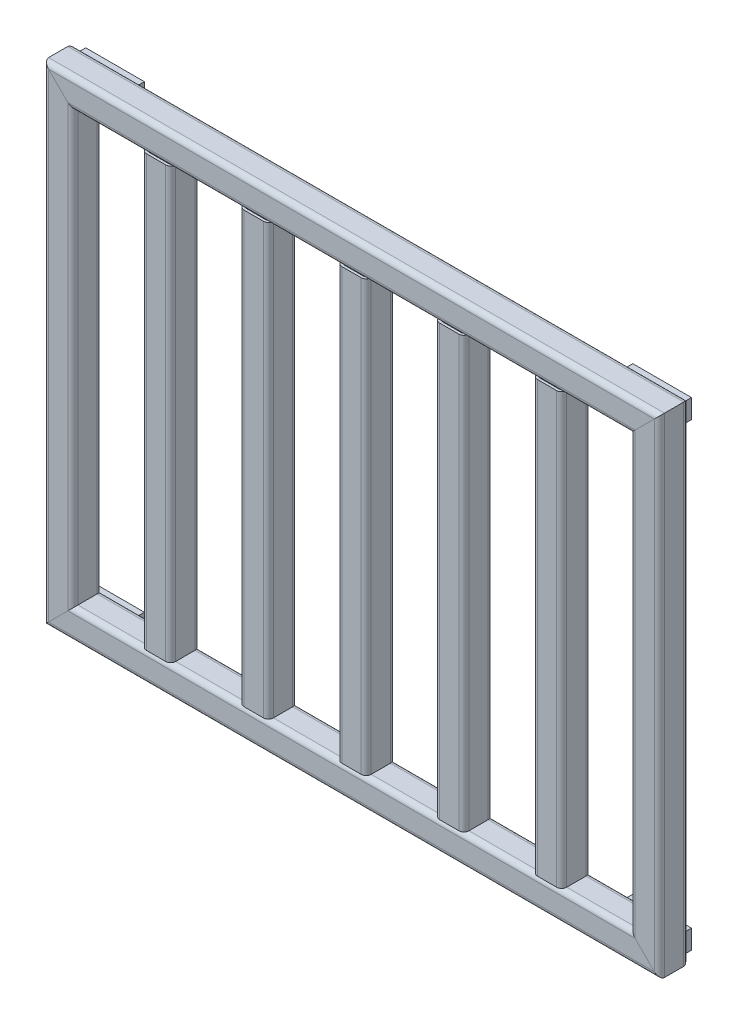
from build123d import *

# Parameters (mm, degrees)
KARE_T_P_30_X_30_X_2_6_1_DEPTH      = 492.213203436
KARE_T_P_30_X_30_X_2_6_1_DEPTH_BACK = 22.213203436
KARE_T_P_30_X_30_X_2_6_1_2_DEPTH    = 644.426406871
KARE_T_P_30_X_30_X_2_6_1_3_DEPTH    = 514.426406871
KARE_T_P_30_X_30_X_2_6_1_4_DEPTH    = 644.426406871
KARE_T_P_30_X_30_X_2_6_1_5_DEPTH    = 472
KARE_T_P_30_X_30_X_2_6_1_6_DEPTH    = 472
KARE_T_P_30_X_30_X_2_6_1_7_DEPTH    = 472
KARE_T_P_30_X_30_X_2_6_1_8_DEPTH    = 472
KARE_T_P_30_X_30_X_2_6_1_9_DEPTH    = 472
IZIM2_W                             = 60
IZIM2_H                             = 19.6
Y_KSEKLIK_EKSTR_ZYON1_DEPTH         = 8
Y_KSEKLIK_EKSTR_ZYON1_2_DEPTH       = 8
Y_KSEKLIK_EKSTR_ZYON1_3_DEPTH       = 8
Y_KSEKLIK_EKSTR_ZYON1_4_DEPTH       = 8


with BuildPart() as part:
    # Sketch1 → Kare tüp 30 X 30 X 2.6(1) (new, two sides: drawn at the far end of the back side and taken through both)
    with BuildSketch(Plane(origin=(300, 235, 0), x_dir=(1, 0, 0), z_dir=(0, -1, 0)).offset(-KARE_T_P_30_X_30_X_2_6_1_DEPTH_BACK)):
        with BuildLine():
            Line((-9.8, -15), (9.8, -15))
            ThreePointArc((9.8, -15), (13.476955262, -13.476955262), (15, -9.8))
            Line((15, -9.8), (15, 9.8))
            ThreePointArc((15, 9.8), (13.476955262, 13.476955262), (9.8, 15))
            Line((9.8, 15), (-9.8, 15))
            ThreePointArc((-9.8, 15), (-13.476955262, 13.476955262), (-15, 9.8))
            Line((-15, 9.8), (-15, -9.8))
            ThreePointArc((-15, -9.8), (-13.476955262, -13.476955262), (-9.8, -15))
        make_face()
        with BuildLine():
            Line((-9.8, -12.4), (9.8, -12.4))
            ThreePointArc((9.8, -12.4), (11.638477631, -11.638477631), (12.4, -9.8))
            Line((12.4, -9.8), (12.4, 9.8))
            ThreePointArc((12.4, 9.8), (11.638477631, 11.638477631), (9.8, 12.4))
            Line((9.8, 12.4), (-9.8, 12.4))
            ThreePointArc((-9.8, 12.4), (-11.638477631, 11.638477631), (-12.4, 9.8))
            Line((-12.4, 9.8), (-12.4, -9.8))
            ThreePointArc((-12.4, -9.8), (-11.638477631, -11.638477631), (-9.8, -12.4))
        make_face(mode=Mode.SUBTRACT)
    extrude(amount=KARE_T_P_30_X_30_X_2_6_1_DEPTH + KARE_T_P_30_X_30_X_2_6_1_DEPTH_BACK)

    # Kare tüp 30 X 30 X 2.6(1) mitre 1
    split(bisect_by=Plane(origin=(300, 235, 0), x_dir=(0.707106781, 0.707106781, 0), z_dir=(0.707106781, -0.707106781, 0)), keep=Keep.TOP)

    # Kare tüp 30 X 30 X 2.6(1) mitre 2
    split(bisect_by=Plane(origin=(300, -235, 0), x_dir=(-0.707106781, 0.707106781, 0), z_dir=(0.707106781, 0.707106781, 0)), keep=Keep.TOP)


with BuildPart() as body_2:
    # Sketch1 on segment 2 (carried to segment 2) → Kare t_p 30 X 30 X 2.6_1 2 (new body)
    with BuildSketch(Plane(origin=(322.213203436, -235, 0), x_dir=(0, -1, 0), z_dir=(-1, 0, 0))):
        with BuildLine():
            Line((-9.8, -15), (9.8, -15))
            ThreePointArc((9.8, -15), (13.476955262, -13.476955262), (15, -9.8))
            Line((15, -9.8), (15, 9.8))
            ThreePointArc((15, 9.8), (13.476955262, 13.476955262), (9.8, 15))
            Line((9.8, 15), (-9.8, 15))
            ThreePointArc((-9.8, 15), (-13.476955262, 13.476955262), (-15, 9.8))
            Line((-15, 9.8), (-15, -9.8))
            ThreePointArc((-15, -9.8), (-13.476955262, -13.476955262), (-9.8, -15))
        make_face()
        with BuildLine():
            Line((-9.8, -12.4), (9.8, -12.4))
            ThreePointArc((9.8, -12.4), (11.638477631, -11.638477631), (12.4, -9.8))
            Line((12.4, -9.8), (12.4, 9.8))
            ThreePointArc((12.4, 9.8), (11.638477631, 11.638477631), (9.8, 12.4))
            Line((9.8, 12.4), (-9.8, 12.4))
            ThreePointArc((-9.8, 12.4), (-11.638477631, 11.638477631), (-12.4, 9.8))
            Line((-12.4, 9.8), (-12.4, -9.8))
            ThreePointArc((-12.4, -9.8), (-11.638477631, -11.638477631), (-9.8, -12.4))
        make_face(mode=Mode.SUBTRACT)
    extrude(amount=KARE_T_P_30_X_30_X_2_6_1_2_DEPTH)

    # Kare t_p 30 X 30 X 2.6_1 2 mitre 1
    split(bisect_by=Plane(origin=(-300, -235, 0), x_dir=(0.707106781, 0.707106781, 0), z_dir=(0.707106781, -0.707106781, 0)), keep=Keep.TOP)

    # Kare t_p 30 X 30 X 2.6_1 2 mitre 2
    split(bisect_by=Plane(origin=(300, -235, 0), x_dir=(0.707106781, -0.707106781, 0), z_dir=(-0.707106781, -0.707106781, 0)), keep=Keep.TOP)


with BuildPart() as body_3:
    # Sketch1 on segment 3 (carried to segment 3) → Kare t_p 30 X 30 X 2.6_1 3 (new body)
    with BuildSketch(Plane(origin=(-300, -257.213203436, 0), x_dir=(-1, 0, 0), z_dir=(0, 1, 0))):
        with BuildLine():
            Line((-9.8, -15), (9.8, -15))
            ThreePointArc((9.8, -15), (13.476955262, -13.476955262), (15, -9.8))
            Line((15, -9.8), (15, 9.8))
            ThreePointArc((15, 9.8), (13.476955262, 13.476955262), (9.8, 15))
            Line((9.8, 15), (-9.8, 15))
            ThreePointArc((-9.8, 15), (-13.476955262, 13.476955262), (-15, 9.8))
            Line((-15, 9.8), (-15, -9.8))
            ThreePointArc((-15, -9.8), (-13.476955262, -13.476955262), (-9.8, -15))
        make_face()
        with BuildLine():
            Line((-9.8, -12.4), (9.8, -12.4))
            ThreePointArc((9.8, -12.4), (11.638477631, -11.638477631), (12.4, -9.8))
            Line((12.4, -9.8), (12.4, 9.8))
            ThreePointArc((12.4, 9.8), (11.638477631, 11.638477631), (9.8, 12.4))
            Line((9.8, 12.4), (-9.8, 12.4))
            ThreePointArc((-9.8, 12.4), (-11.638477631, 11.638477631), (-12.4, 9.8))
            Line((-12.4, 9.8), (-12.4, -9.8))
            ThreePointArc((-12.4, -9.8), (-11.638477631, -11.638477631), (-9.8, -12.4))
        make_face(mode=Mode.SUBTRACT)
    extrude(amount=KARE_T_P_30_X_30_X_2_6_1_3_DEPTH)

    # Kare t_p 30 X 30 X 2.6_1 3 mitre 1
    split(bisect_by=Plane(origin=(-300, 235, 0), x_dir=(0.707106781, -0.707106781, 0), z_dir=(-0.707106781, -0.707106781, 0)), keep=Keep.TOP)

    # Kare t_p 30 X 30 X 2.6_1 3 mitre 2
    split(bisect_by=Plane(origin=(-300, -235, 0), x_dir=(-0.707106781, -0.707106781, 0), z_dir=(-0.707106781, 0.707106781, 0)), keep=Keep.TOP)


with BuildPart() as body_4:
    # Sketch1 on segment 4 (carried to segment 4) → Kare t_p 30 X 30 X 2.6_1 4 (new body)
    with BuildSketch(Plane(origin=(-322.213203436, 235, 0), x_dir=(0, 1, 0), z_dir=(1, 0, 0))):
        with BuildLine():
            Line((-9.8, -15), (9.8, -15))
            ThreePointArc((9.8, -15), (13.476955262, -13.476955262), (15, -9.8))
            Line((15, -9.8), (15, 9.8))
            ThreePointArc((15, 9.8), (13.476955262, 13.476955262), (9.8, 15))
            Line((9.8, 15), (-9.8, 15))
            ThreePointArc((-9.8, 15), (-13.476955262, 13.476955262), (-15, 9.8))
            Line((-15, 9.8), (-15, -9.8))
            ThreePointArc((-15, -9.8), (-13.476955262, -13.476955262), (-9.8, -15))
        make_face()
        with BuildLine():
            Line((-9.8, -12.4), (9.8, -12.4))
            ThreePointArc((9.8, -12.4), (11.638477631, -11.638477631), (12.4, -9.8))
            Line((12.4, -9.8), (12.4, 9.8))
            ThreePointArc((12.4, 9.8), (11.638477631, 11.638477631), (9.8, 12.4))
            Line((9.8, 12.4), (-9.8, 12.4))
            ThreePointArc((-9.8, 12.4), (-11.638477631, 11.638477631), (-12.4, 9.8))
            Line((-12.4, 9.8), (-12.4, -9.8))
            ThreePointArc((-12.4, -9.8), (-11.638477631, -11.638477631), (-9.8, -12.4))
        make_face(mode=Mode.SUBTRACT)
    extrude(amount=KARE_T_P_30_X_30_X_2_6_1_4_DEPTH)

    # Kare t_p 30 X 30 X 2.6_1 4 mitre 1
    split(bisect_by=Plane(origin=(-300, 235, 0), x_dir=(-0.707106781, 0.707106781, 0), z_dir=(0.707106781, 0.707106781, 0)), keep=Keep.TOP)

    # Kare t_p 30 X 30 X 2.6_1 4 mitre 2
    split(bisect_by=Plane(origin=(300, 235, 0), x_dir=(-0.707106781, -0.707106781, 0), z_dir=(-0.707106781, 0.707106781, 0)), keep=Keep.TOP)


with BuildPart() as body_5:
    # Sketch1 on segment 5 (carried to segment 5) → Kare t_p 30 X 30 X 2.6_1 5 (new body)
    with BuildSketch(Plane(origin=(200, 236, 0), x_dir=(1, 0, 0), z_dir=(0, -1, 0))):
        with BuildLine():
            Line((-9.8, -15), (9.8, -15))
            ThreePointArc((9.8, -15), (13.476955262, -13.476955262), (15, -9.8))
            Line((15, -9.8), (15, 9.8))
            ThreePointArc((15, 9.8), (13.476955262, 13.476955262), (9.8, 15))
            Line((9.8, 15), (-9.8, 15))
            ThreePointArc((-9.8, 15), (-13.476955262, 13.476955262), (-15, 9.8))
            Line((-15, 9.8), (-15, -9.8))
            ThreePointArc((-15, -9.8), (-13.476955262, -13.476955262), (-9.8, -15))
        make_face()
        with BuildLine():
            Line((-9.8, -12.4), (9.8, -12.4))
            ThreePointArc((9.8, -12.4), (11.638477631, -11.638477631), (12.4, -9.8))
            Line((12.4, -9.8), (12.4, 9.8))
            ThreePointArc((12.4, 9.8), (11.638477631, 11.638477631), (9.8, 12.4))
            Line((9.8, 12.4), (-9.8, 12.4))
            ThreePointArc((-9.8, 12.4), (-11.638477631, 11.638477631), (-12.4, 9.8))
            Line((-12.4, 9.8), (-12.4, -9.8))
            ThreePointArc((-12.4, -9.8), (-11.638477631, -11.638477631), (-9.8, -12.4))
        make_face(mode=Mode.SUBTRACT)
    extrude(amount=KARE_T_P_30_X_30_X_2_6_1_5_DEPTH)

    # Kare t_p 30 X 30 X 2.6_1 5 mitre 1
    split(bisect_by=Plane(origin=(200, 220, 0), x_dir=(1, 0, 0), z_dir=(0, -1, 0)), keep=Keep.TOP)

    # Kare t_p 30 X 30 X 2.6_1 5 mitre 2
    split(bisect_by=Plane(origin=(200, -220, 0), x_dir=(-1, 0, 0), z_dir=(0, 1, 0)), keep=Keep.TOP)


with BuildPart() as body_6:
    # Sketch1 on segment 6 (carried to segment 6) → Kare t_p 30 X 30 X 2.6_1 6 (new body)
    with BuildSketch(Plane(origin=(100, 236, 0), x_dir=(1, 0, 0), z_dir=(0, -1, 0))):
        with BuildLine():
            Line((-9.8, -15), (9.8, -15))
            ThreePointArc((9.8, -15), (13.476955262, -13.476955262), (15, -9.8))
            Line((15, -9.8), (15, 9.8))
            ThreePointArc((15, 9.8), (13.476955262, 13.476955262), (9.8, 15))
            Line((9.8, 15), (-9.8, 15))
            ThreePointArc((-9.8, 15), (-13.476955262, 13.476955262), (-15, 9.8))
            Line((-15, 9.8), (-15, -9.8))
            ThreePointArc((-15, -9.8), (-13.476955262, -13.476955262), (-9.8, -15))
        make_face()
        with BuildLine():
            Line((-9.8, -12.4), (9.8, -12.4))
            ThreePointArc((9.8, -12.4), (11.638477631, -11.638477631), (12.4, -9.8))
            Line((12.4, -9.8), (12.4, 9.8))
            ThreePointArc((12.4, 9.8), (11.638477631, 11.638477631), (9.8, 12.4))
            Line((9.8, 12.4), (-9.8, 12.4))
            ThreePointArc((-9.8, 12.4), (-11.638477631, 11.638477631), (-12.4, 9.8))
            Line((-12.4, 9.8), (-12.4, -9.8))
            ThreePointArc((-12.4, -9.8), (-11.638477631, -11.638477631), (-9.8, -12.4))
        make_face(mode=Mode.SUBTRACT)
    extrude(amount=KARE_T_P_30_X_30_X_2_6_1_6_DEPTH)

    # Kare t_p 30 X 30 X 2.6_1 6 mitre 1
    split(bisect_by=Plane(origin=(100, 220, 0), x_dir=(1, 0, 0), z_dir=(0, -1, 0)), keep=Keep.TOP)

    # Kare t_p 30 X 30 X 2.6_1 6 mitre 2
    split(bisect_by=Plane(origin=(100, -220, 0), x_dir=(-1, 0, 0), z_dir=(0, 1, 0)), keep=Keep.TOP)


with BuildPart() as body_7:
    # Sketch1 on segment 7 (carried to segment 7) → Kare t_p 30 X 30 X 2.6_1 7 (new body)
    with BuildSketch(Plane.XZ.offset(-236)):
        with BuildLine():
            Line((-9.8, -15), (9.8, -15))
            ThreePointArc((9.8, -15), (13.476955262, -13.476955262), (15, -9.8))
            Line((15, -9.8), (15, 9.8))
            ThreePointArc((15, 9.8), (13.476955262, 13.476955262), (9.8, 15))
            Line((9.8, 15), (-9.8, 15))
            ThreePointArc((-9.8, 15), (-13.476955262, 13.476955262), (-15, 9.8))
            Line((-15, 9.8), (-15, -9.8))
            ThreePointArc((-15, -9.8), (-13.476955262, -13.476955262), (-9.8, -15))
        make_face()
        with BuildLine():
            Line((-9.8, -12.4), (9.8, -12.4))
            ThreePointArc((9.8, -12.4), (11.638477631, -11.638477631), (12.4, -9.8))
            Line((12.4, -9.8), (12.4, 9.8))
            ThreePointArc((12.4, 9.8), (11.638477631, 11.638477631), (9.8, 12.4))
            Line((9.8, 12.4), (-9.8, 12.4))
            ThreePointArc((-9.8, 12.4), (-11.638477631, 11.638477631), (-12.4, 9.8))
            Line((-12.4, 9.8), (-12.4, -9.8))
            ThreePointArc((-12.4, -9.8), (-11.638477631, -11.638477631), (-9.8, -12.4))
        make_face(mode=Mode.SUBTRACT)
    extrude(amount=KARE_T_P_30_X_30_X_2_6_1_7_DEPTH)

    # Kare t_p 30 X 30 X 2.6_1 7 mitre 1
    split(bisect_by=Plane.XZ.offset(-220), keep=Keep.TOP)

    # Kare t_p 30 X 30 X 2.6_1 7 mitre 2
    split(bisect_by=Plane(origin=(0, -220, 0), x_dir=(-1, 0, 0), z_dir=(0, 1, 0)), keep=Keep.TOP)


with BuildPart() as body_8:
    # Sketch1 on segment 8 (carried to segment 8) → Kare t_p 30 X 30 X 2.6_1 8 (new body)
    with BuildSketch(Plane(origin=(-100, 236, 0), x_dir=(1, 0, 0), z_dir=(0, -1, 0))):
        with BuildLine():
            Line((-9.8, -15), (9.8, -15))
            ThreePointArc((9.8, -15), (13.476955262, -13.476955262), (15, -9.8))
            Line((15, -9.8), (15, 9.8))
            ThreePointArc((15, 9.8), (13.476955262, 13.476955262), (9.8, 15))
            Line((9.8, 15), (-9.8, 15))
            ThreePointArc((-9.8, 15), (-13.476955262, 13.476955262), (-15, 9.8))
            Line((-15, 9.8), (-15, -9.8))
            ThreePointArc((-15, -9.8), (-13.476955262, -13.476955262), (-9.8, -15))
        make_face()
        with BuildLine():
            Line((-9.8, -12.4), (9.8, -12.4))
            ThreePointArc((9.8, -12.4), (11.638477631, -11.638477631), (12.4, -9.8))
            Line((12.4, -9.8), (12.4, 9.8))
            ThreePointArc((12.4, 9.8), (11.638477631, 11.638477631), (9.8, 12.4))
            Line((9.8, 12.4), (-9.8, 12.4))
            ThreePointArc((-9.8, 12.4), (-11.638477631, 11.638477631), (-12.4, 9.8))
            Line((-12.4, 9.8), (-12.4, -9.8))
            ThreePointArc((-12.4, -9.8), (-11.638477631, -11.638477631), (-9.8, -12.4))
        make_face(mode=Mode.SUBTRACT)
    extrude(amount=KARE_T_P_30_X_30_X_2_6_1_8_DEPTH)

    # Kare t_p 30 X 30 X 2.6_1 8 mitre 1
    split(bisect_by=Plane(origin=(-100, 220, 0), x_dir=(1, 0, 0), z_dir=(0, -1, 0)), keep=Keep.TOP)

    # Kare t_p 30 X 30 X 2.6_1 8 mitre 2
    split(bisect_by=Plane(origin=(-100, -220, 0), x_dir=(-1, 0, 0), z_dir=(0, 1, 0)), keep=Keep.TOP)


with BuildPart() as body_9:
    # Sketch1 on segment 9 (carried to segment 9) → Kare t_p 30 X 30 X 2.6_1 9 (new body)
    with BuildSketch(Plane(origin=(-200, 236, 0), x_dir=(1, 0, 0), z_dir=(0, -1, 0))):
        with BuildLine():
            Line((-9.8, -15), (9.8, -15))
            ThreePointArc((9.8, -15), (13.476955262, -13.476955262), (15, -9.8))
            Line((15, -9.8), (15, 9.8))
            ThreePointArc((15, 9.8), (13.476955262, 13.476955262), (9.8, 15))
            Line((9.8, 15), (-9.8, 15))
            ThreePointArc((-9.8, 15), (-13.476955262, 13.476955262), (-15, 9.8))
            Line((-15, 9.8), (-15, -9.8))
            ThreePointArc((-15, -9.8), (-13.476955262, -13.476955262), (-9.8, -15))
        make_face()
        with BuildLine():
            Line((-9.8, -12.4), (9.8, -12.4))
            ThreePointArc((9.8, -12.4), (11.638477631, -11.638477631), (12.4, -9.8))
            Line((12.4, -9.8), (12.4, 9.8))
            ThreePointArc((12.4, 9.8), (11.638477631, 11.638477631), (9.8, 12.4))
            Line((9.8, 12.4), (-9.8, 12.4))
            ThreePointArc((-9.8, 12.4), (-11.638477631, 11.638477631), (-12.4, 9.8))
            Line((-12.4, 9.8), (-12.4, -9.8))
            ThreePointArc((-12.4, -9.8), (-11.638477631, -11.638477631), (-9.8, -12.4))
        make_face(mode=Mode.SUBTRACT)
    extrude(amount=KARE_T_P_30_X_30_X_2_6_1_9_DEPTH)

    # Kare t_p 30 X 30 X 2.6_1 9 mitre 1
    split(bisect_by=Plane(origin=(-200, 220, 0), x_dir=(1, 0, 0), z_dir=(0, -1, 0)), keep=Keep.TOP)

    # Kare t_p 30 X 30 X 2.6_1 9 mitre 2
    split(bisect_by=Plane(origin=(-200, -220, 0), x_dir=(-1, 0, 0), z_dir=(0, 1, 0)), keep=Keep.TOP)


with BuildPart() as body_10:
    # Çizim2 → Yükseklik-Ekstrüzyon1 (new body)
    with BuildSketch(Plane(origin=(0, 0, -15), x_dir=(-1, 0, 0), z_dir=(0, 0, -1))):
        with Locations((-279.8, -235)):
            Rectangle(IZIM2_W, IZIM2_H)
    extrude(amount=Y_KSEKLIK_EKSTR_ZYON1_DEPTH)


with BuildPart() as body_11:
    # Çizim2 → Y_kseklik-Ekstr_zyon1 2 (new body)
    with BuildSketch(Plane(origin=(0, 0, -15), x_dir=(-1, 0, 0), z_dir=(0, 0, -1))):
        with Locations((-279.8, 235)):
            Rectangle(IZIM2_W, IZIM2_H)
    extrude(amount=Y_KSEKLIK_EKSTR_ZYON1_2_DEPTH)


with BuildPart() as body_12:
    # Çizim2 → Y_kseklik-Ekstr_zyon1 3 (new body)
    with BuildSketch(Plane(origin=(0, 0, -15), x_dir=(-1, 0, 0), z_dir=(0, 0, -1))):
        with Locations((279.8, 235)):
            Rectangle(IZIM2_W, IZIM2_H)
    extrude(amount=Y_KSEKLIK_EKSTR_ZYON1_3_DEPTH)


with BuildPart() as body_13:
    # Çizim2 → Y_kseklik-Ekstr_zyon1 4 (new body)
    with BuildSketch(Plane(origin=(0, 0, -15), x_dir=(-1, 0, 0), z_dir=(0, 0, -1))):
        with Locations((279.8, -235)):
            Rectangle(IZIM2_W, IZIM2_H)
    extrude(amount=Y_KSEKLIK_EKSTR_ZYON1_4_DEPTH)


solid = Compound([part.part, body_2.part, body_3.part, body_4.part, body_5.part, body_6.part, body_7.part, body_8.part, body_9.part, body_10.part, body_11.part, body_12.part, body_13.part])
